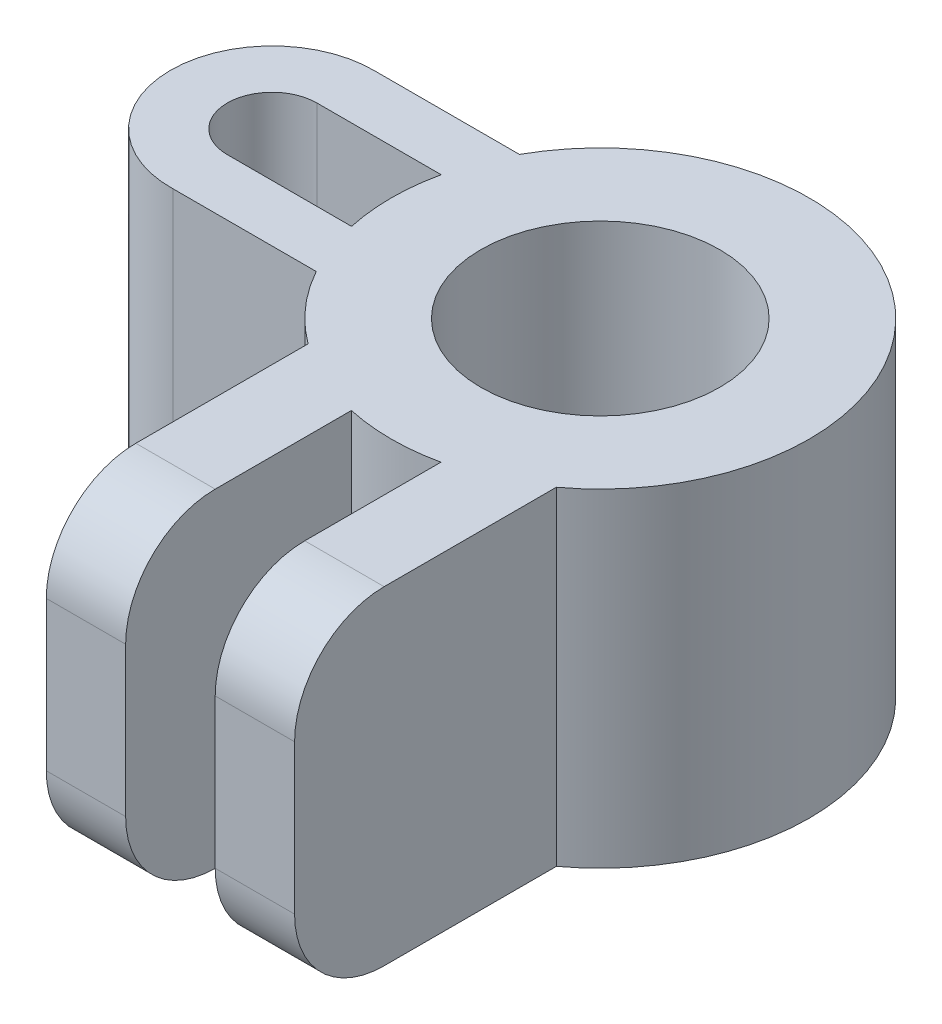
from build123d import *

# Parameters (mm, degrees)
SKETCH2_R           = 20
BOSS_EXTRUDE3_DEPTH = 55
FILLET1_R           = 15


with BuildPart() as part:
    # Sketch2 → Boss-Extrude3 (new body)
    with BuildSketch(Plane(origin=(0, 0, 0), x_dir=(1, 0, 0), z_dir=(0, 1, 0))):
        with BuildLine():
            Line((-20.795375831, -28.152306194), (-20.795375831, -72))
            Line((-20.795375831, -72), (-7.5, -72))
            Line((-7.5, -72), (-7.5, -34.186985828))
            ThreePointArc((-7.5, -34.186985828), (0, -35), (7.5, -34.186985828))
            Line((7.5, -34.186985828), (7.5, -72))
            Line((7.5, -72), (20.795375831, -72))
            Line((20.795375831, -72), (20.795375831, -28.152306194))
            ThreePointArc((20.795375831, -28.152306194), (23.114885766, 26.281211083), (-30.576990341, 17.030785705))
            Line((-30.576990341, 17.030785705), (-54.576990341, 17.030785705))
            ThreePointArc((-54.576990341, 17.030785705), (-72.004836058, 0.048305486), (-54.611203279, -16.969214295))
            Line((-54.611203279, -16.969214295), (-30.611203279, -16.969214295))
            ThreePointArc((-30.611203279, -16.969214295), (-26.304457418, -23.088428269), (-20.795375831, -28.152306194))
        make_face()
        with BuildLine():
            ThreePointArc((-34.180128859, 7.531187899), (-34.999985436, 0.031929592), (-34.193812975, -7.468812101))
            Line((-34.193812975, -7.468812101), (-54.999991154, -7.468812101))
            ThreePointArc((-54.999991154, -7.468812101), (-62.499994275, 0.038036202), (-54.986307038, 7.531187899))
            Line((-54.986307038, 7.531187899), (-34.180128859, 7.531187899))
        make_face(mode=Mode.SUBTRACT)
        with Locations(Location((0, 0, 0), (0, 0, 270))):
            Circle(SKETCH2_R, mode=Mode.SUBTRACT)
    extrude(amount=BOSS_EXTRUDE3_DEPTH)

    # Fillet1
    fillet1_edges = [part.edges().sort_by_distance(p)[0] for p in [
        (-14.147687915, 0, 72),
        (14.147687915, 0, 72),
        (14.147687915, 55, 72),
        (-14.147687915, 55, 72),
    ]]
    fillet(fillet1_edges, radius=FILLET1_R)


solid = part.part
